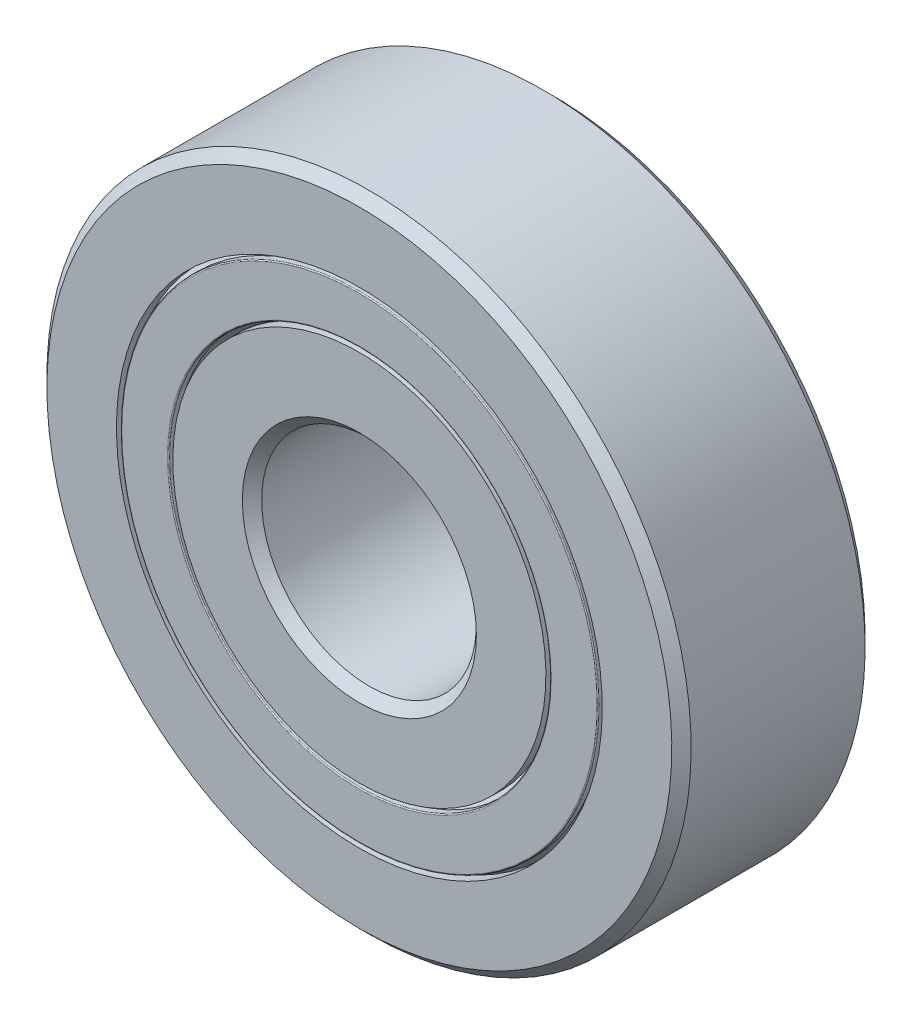
from build123d import *

# Parameters (mm, degrees)
CIRPATTERN1_COUNT   = 8
SKETCH7_R           = 10.65625
SKETCH7_R_2         = 10
BOSS_EXTRUDE1_DEPTH = 0.75
FILLET1_R           = 0.05
FILLET2_R           = 0.05


with BuildPart() as part:
    # Sketch3 → Revolve1 (revolve)
    with BuildSketch(Plane(origin=(0, 0, 0), x_dir=(0, 0, -1), z_dir=(1, 0, 0)), mode=Mode.PRIVATE) as revolve1_sk:
        with BuildLine():
            Line((4.05, 15), (4.5, 14.55))
            Line((4.5, 14.55), (4.5, 11.3125))
            Line((4.5, 11.3125), (2, 11.3125))
            ThreePointArc((2, 11.3125), (0, 12.392207401), (-2, 11.3125))
            Line((-2, 11.3125), (-4.5, 11.3125))
            Line((-4.5, 11.3125), (-4.5, 14.55))
            Line((-4.5, 14.55), (-4.05, 15))
            Line((-4.05, 15), (4.05, 15))
        make_face()
    revolve(revolve1_sk.sketch.rotate(Axis((0, 0, 4.5), (0, 0, -1)), 180), axis=Axis((0, 0, 4.5), (0, 0, -1)))


with BuildPart() as body_2:
    # Sketch4 → Revolve2 (revolve)
    with BuildSketch(Plane(origin=(0, 0, 0), x_dir=(0, 0, -1), z_dir=(1, 0, 0)), mode=Mode.PRIVATE) as revolve2_sk:
        with BuildLine():
            Line((-4.05, 5), (-4.5, 5.45))
            Line((-4.5, 5.45), (-4.5, 8.6875))
            Line((-4.5, 8.6875), (-2, 8.6875))
            ThreePointArc((-2, 8.6875), (0, 7.607792599), (2, 8.6875))
            Line((2, 8.6875), (4.5, 8.6875))
            Line((4.5, 8.6875), (4.5, 5.45))
            Line((4.5, 5.45), (4.05, 5))
            Line((4.05, 5), (-4.05, 5))
        make_face()
    revolve(revolve2_sk.sketch.rotate(Axis((0, 0, 4.5), (0, 0, -1)), 180), axis=Axis((0, 0, 4.5), (0, 0, -1)))


with BuildPart() as body_3:
    # Sketch5 → Revolve3 (revolve)
    with BuildSketch(Plane(origin=(0, 0, 0), x_dir=(0, 0, -1), z_dir=(1, 0, 0))):
        with BuildLine():
            Line((-2.392207401, 10), (2.392207401, 10))
            ThreePointArc((2.392207401, 10), (0, 12.392207401), (-2.392207401, 10))
        make_face()
    revolve(axis=Axis((0, 10, 2.392207401), (0, 0, -1)))


with BuildPart() as body_4:
    # Sketch6 → Revolve4 (revolve)
    with BuildSketch(Plane(origin=(0, 0, 0), x_dir=(0, 0, -1), z_dir=(1, 0, 0))):
        with BuildLine():
            Line((-2.300433043, 10.65625), (-2.667027536, 10.65625))
            ThreePointArc((-2.667027536, 10.65625), (-2.850324783, 10), (-2.667027536, 9.34375))
            Line((-2.667027536, 9.34375), (-2.300433043, 9.34375))
            ThreePointArc((-2.300433043, 9.34375), (-2.392207401, 10), (-2.300433043, 10.65625))
        make_face()
    revolve(axis=Axis((0, 15, 0), (0, -1, 0)))


with BuildPart() as cirpattern1_1:
    # CirPattern1: pattern copy
    add(body_4.part.rotate(Axis((0, 0, 0), (0, 0, 1)), 1 * 360 / CIRPATTERN1_COUNT))


with BuildPart() as cirpattern1_2:
    # CirPattern1: pattern copy
    add(body_4.part.rotate(Axis((0, 0, 0), (0, 0, 1)), 2 * 360 / CIRPATTERN1_COUNT))


with BuildPart() as cirpattern1_3:
    # CirPattern1: pattern copy
    add(body_4.part.rotate(Axis((0, 0, 0), (0, 0, 1)), 3 * 360 / CIRPATTERN1_COUNT))


with BuildPart() as cirpattern1_4:
    # CirPattern1: pattern copy
    add(body_4.part.rotate(Axis((0, 0, 0), (0, 0, 1)), 4 * 360 / CIRPATTERN1_COUNT))


with BuildPart() as cirpattern1_5:
    # CirPattern1: pattern copy
    add(body_4.part.rotate(Axis((0, 0, 0), (0, 0, 1)), 5 * 360 / CIRPATTERN1_COUNT))


with BuildPart() as cirpattern1_6:
    # CirPattern1: pattern copy
    add(body_4.part.rotate(Axis((0, 0, 0), (0, 0, 1)), 6 * 360 / CIRPATTERN1_COUNT))


with BuildPart() as cirpattern1_7:
    # CirPattern1: pattern copy
    add(body_4.part.rotate(Axis((0, 0, 0), (0, 0, 1)), 7 * 360 / CIRPATTERN1_COUNT))


with BuildPart() as cirpattern1_8:
    # CirPattern1: pattern copy
    add(body_3.part.rotate(Axis((0, 0, 0), (0, 0, 1)), 1 * 360 / CIRPATTERN1_COUNT))


with BuildPart() as cirpattern1_9:
    # CirPattern1: pattern copy
    add(body_3.part.rotate(Axis((0, 0, 0), (0, 0, 1)), 2 * 360 / CIRPATTERN1_COUNT))


with BuildPart() as cirpattern1_10:
    # CirPattern1: pattern copy
    add(body_3.part.rotate(Axis((0, 0, 0), (0, 0, 1)), 3 * 360 / CIRPATTERN1_COUNT))


with BuildPart() as cirpattern1_11:
    # CirPattern1: pattern copy
    add(body_3.part.rotate(Axis((0, 0, 0), (0, 0, 1)), 4 * 360 / CIRPATTERN1_COUNT))


with BuildPart() as cirpattern1_12:
    # CirPattern1: pattern copy
    add(body_3.part.rotate(Axis((0, 0, 0), (0, 0, 1)), 5 * 360 / CIRPATTERN1_COUNT))


with BuildPart() as cirpattern1_13:
    # CirPattern1: pattern copy
    add(body_3.part.rotate(Axis((0, 0, 0), (0, 0, 1)), 6 * 360 / CIRPATTERN1_COUNT))


with BuildPart() as cirpattern1_14:
    # CirPattern1: pattern copy
    add(body_3.part.rotate(Axis((0, 0, 0), (0, 0, 1)), 7 * 360 / CIRPATTERN1_COUNT))


with BuildPart() as body_19:
    # Sketch7 → Boss-Extrude1 (new, symmetric)
    with BuildSketch(Plane.XY):
        Circle(SKETCH7_R)
        Circle(SKETCH7_R_2, mode=Mode.SUBTRACT)
    extrude(amount=BOSS_EXTRUDE1_DEPTH, both=True)


with BuildPart() as body_20:
    # Sketch8 → Revolve5 (revolve)
    with BuildSketch(Plane(origin=(0, 0, 0), x_dir=(0, 0, -1), z_dir=(1, 0, 0)), mode=Mode.PRIVATE) as revolve5_sk:
        Polygon((-4.5, 11.115625), (-4.166666667, 11.115625), (-4, 11.3125), (-4, 11.115625), (-4, 8.884375), (-4, 8.6875), (-4.166666667, 8.884375), (-4.5, 8.884375), align=None)
        Polygon((4.5, 11.115625), (4.5, 8.884375), (4.166666667, 8.884375), (4, 8.6875), (4, 8.884375), (4, 11.115625), (4, 11.3125), (4.166666667, 11.115625), align=None)
    revolve(revolve5_sk.sketch.rotate(Axis((0, 0, 4.5), (0, 0, -1)), 180), axis=Axis((0, 0, 4.5), (0, 0, -1)))

    # Fillet1
    fillet1_edges = [body_20.edges().sort_by_distance(p)[0] for p in [
        (0, 11.115625, 4.5),
        (0, 8.884375, 4.5),
    ]]
    fillet(fillet1_edges, radius=FILLET1_R)

    # Fillet2
    fillet2_edges = [body_20.edges().sort_by_distance(p)[0] for p in [
        (0, 11.115625, -4.5),
        (0, 8.884375, -4.5),
    ]]
    fillet(fillet2_edges, radius=FILLET2_R)


solid = Compound([part.part, body_2.part, body_3.part, body_4.part, cirpattern1_1.part, cirpattern1_2.part, cirpattern1_3.part, cirpattern1_4.part, cirpattern1_5.part, cirpattern1_6.part, cirpattern1_7.part, cirpattern1_8.part, cirpattern1_9.part, cirpattern1_10.part, cirpattern1_11.part, cirpattern1_12.part, cirpattern1_13.part, cirpattern1_14.part, body_19.part, body_20.part])
